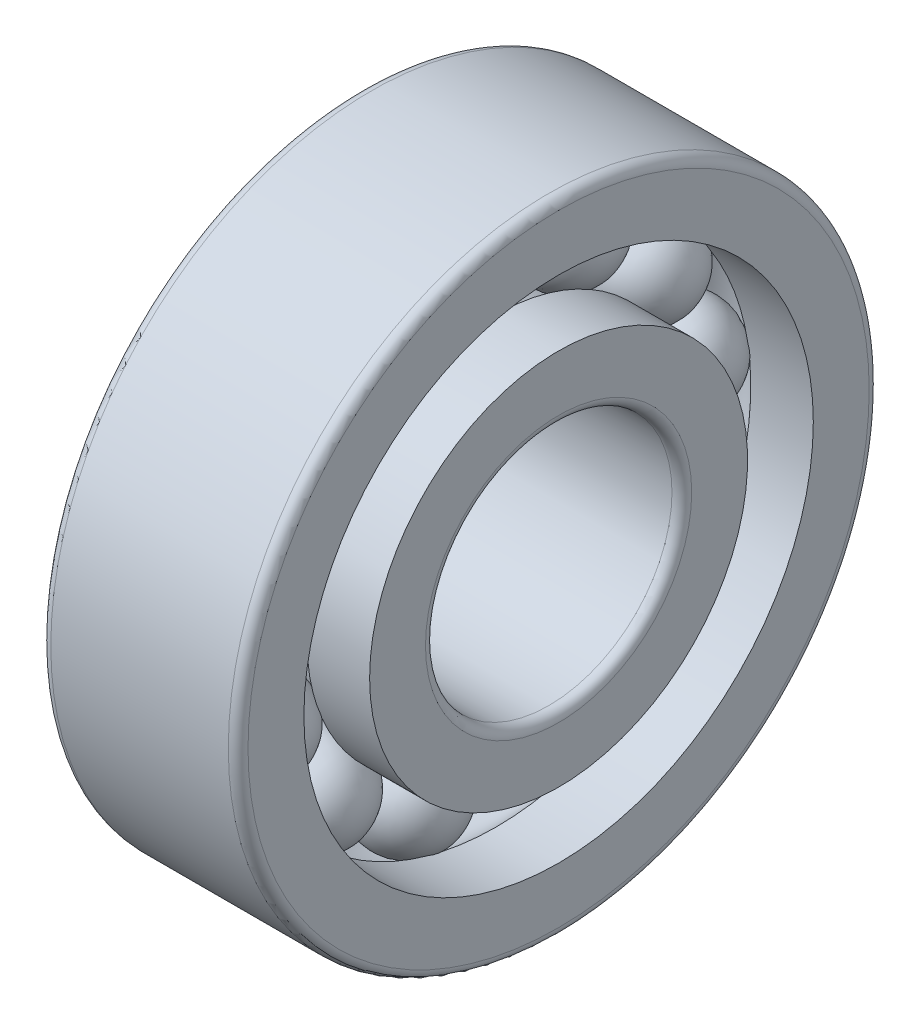
from build123d import *

# Parameters (mm, degrees)
CIRCULAR_PATTERN1_COUNT = 13
FILLET1_R               = 0.2


with BuildPart() as part:
    # Sketch1 → Revolve1 (revolve)
    with BuildSketch(Plane.XY):
        with BuildLine():
            Line((-1, 4.5), (1, 4.5))
            ThreePointArc((1, 4.5), (0, 5.5), (-1, 4.5))
        make_face()
    revolve1 = revolve(axis=Axis((-4.596601835, 4.5, 0), (1, 0, 0)))

    # Sketch2 → Revolve2 (revolve)
    with BuildSketch(Plane.XY, mode=Mode.PRIVATE) as revolve2_sk:
        with BuildLine():
            Line((-2, 3.833333333), (-2, 2.5))
            Line((-2, 2.5), (2, 2.5))
            Line((2, 2.5), (2, 3.833333333))
            Line((2, 3.833333333), (0.731884933, 3.833333333))
            ThreePointArc((0.731884933, 3.833333333), (0, 3.51), (-0.731884933, 3.833333333))
            Line((-0.731884933, 3.833333333), (-2, 3.833333333))
        make_face()
    revolve(revolve2_sk.sketch.rotate(Axis((-6.971390126, 0, 0), (1, 0, 0)), 90), axis=Axis((-6.971390126, 0, 0), (1, 0, 0)))

    # Sketch3 → Revolve3 (revolve)
    with BuildSketch(Plane.XY, mode=Mode.PRIVATE) as revolve3_sk:
        with BuildLine():
            Line((-2, 6.5), (2, 6.5))
            Line((2, 6.5), (2, 5.166666667))
            Line((2, 5.166666667), (0.731884933, 5.166666667))
            ThreePointArc((0.731884933, 5.166666667), (0, 5.49), (-0.731884933, 5.166666667))
            Line((-0.731884933, 5.166666667), (-2, 5.166666667))
            Line((-2, 5.166666667), (-2, 6.5))
        make_face()
    revolve(revolve3_sk.sketch.rotate(Axis((-8.710676495, 0, 0), (1, 0, 0)), 90), axis=Axis((-8.710676495, 0, 0), (1, 0, 0)))

    # Circular-Pattern1: Revolve1 ×13 about axis
    circular_pattern1_axis = Axis((0, 0, 0), (1, 0, 0))
    for i in range(1, CIRCULAR_PATTERN1_COUNT):
        add(revolve1.rotate(circular_pattern1_axis, i * 360 / CIRCULAR_PATTERN1_COUNT))

    # Fillet1
    fillet1_edges = [part.edges().sort_by_distance(p)[0] for p in [
        (-2, 0, -6.5),
        (2, 0, -6.5),
        (-2, 0, -2.5),
        (2, 0, -2.5),
    ]]
    fillet(fillet1_edges, radius=FILLET1_R)


solid = part.part
